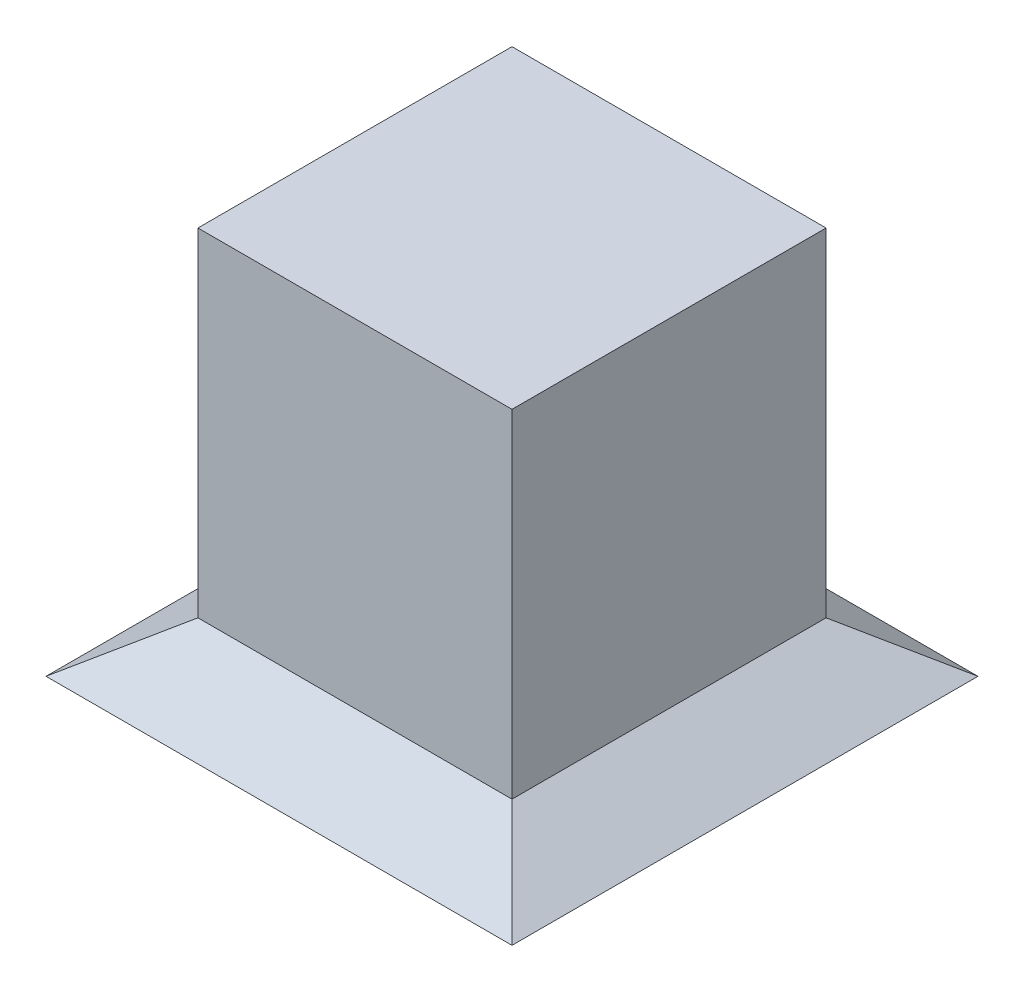
from build123d import *

# Parameters (mm, degrees)
SHELL4_T            = 2
SKETCH8_W           = 37.21110255
SKETCH8_H           = 37.21110255
BOSS_EXTRUDE1_DEPTH = 40


with BuildPart() as part:
    # Sketch1 → Loft1 section 0
    with BuildSketch(Plane(origin=(0, 0, 0), x_dir=(1, 0, 0), z_dir=(0, 1, 0))):
        with BuildLine():
            Line((-24, 24), (24, 24))
            Line((24, 24), (24, -24))
            Line((24, -24), (-24, -24))
            Line((-24, -24), (-24, 24))
        make_face()
    # Sketch2 → Loft1 section 1
    with BuildSketch(Plane(origin=(0, 4, 0), x_dir=(1, 0, 0), z_dir=(0, 1, 0))):
        with BuildLine():
            Line((-18, 18), (18, 18))
            Line((18, 18), (18, -18))
            Line((18, -18), (-18, -18))
            Line((-18, -18), (-18, 18))
        make_face()
    loft()

    # Shell4
    shell4_openings = [part.faces().sort_by_distance(p)[0] for p in [
        (0, 0, 0),
    ]]
    offset(amount=SHELL4_T, openings=shell4_openings, kind=Kind.INTERSECTION)

    # Sketch8 → Boss-Extrude1 (add)
    with BuildSketch(Plane(origin=(0, 6, 0), x_dir=(1, 0, 0), z_dir=(0, 1, 0))):
        Rectangle(SKETCH8_W, SKETCH8_H)
    extrude(amount=BOSS_EXTRUDE1_DEPTH)


solid = part.part
